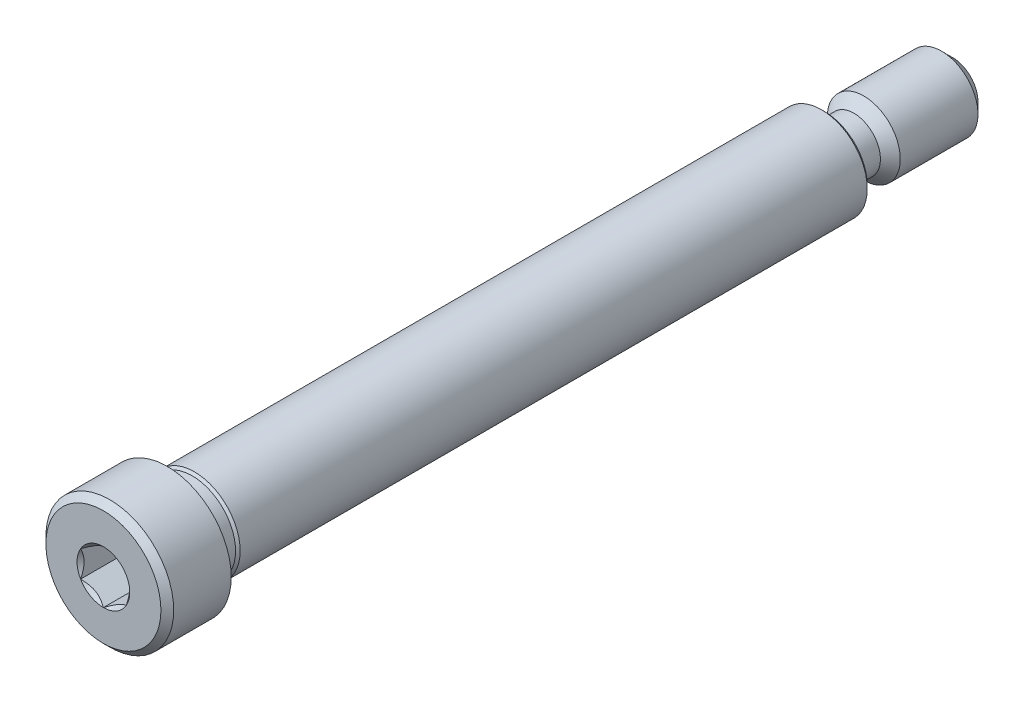
from build123d import *

# Parameters (mm, degrees)
CUT_EXTRUDE1_DEPTH = 4.1671875


with BuildPart() as part:
    # Sketch4 → Revolve1 (revolve)
    with BuildSketch(Plane(origin=(0, 0, 0), x_dir=(0, 0, -1), z_dir=(1, 0, 0)), mode=Mode.PRIVATE) as revolve1_sk:
        Polygon((-31.353125, 5.55625), (-36.35375, 5.55625), (-36.909375, 5.000625), (-36.909375, 0), (25.796875, 0), (25.796875, 3.704166667), (25.532291667, 3.96875), (-28.990925, 3.96875), (-29.1893625, 3.7703125), (-31.1546875, 3.7703125), (-31.353125, 3.96875), align=None)
    revolve(revolve1_sk.sketch.rotate(Axis((0, 0, 36.909375), (0, 0, -1)), 90), axis=Axis((0, 0, 36.909375), (0, 0, -1)))

    # Sketch5 → Cut-Extrude1 (cut)
    with BuildSketch(Plane.XY.offset(36.909375)):
        Polygon((1.984375, 1.14567944), (0, 2.291358881), (-1.984375, 1.14567944), (-1.984375, -1.14567944), (0, -2.291358881), (1.984375, -1.14567944), align=None)
    extrude(amount=-CUT_EXTRUDE1_DEPTH, mode=Mode.SUBTRACT)

    # Cut-Extrude4 cone 1 section (through the dimple's axis) → Cut-Extrude4 (revolve, cut)
    with BuildSketch(Plane(origin=(0, 0, 36.909375), x_dir=(0, -1, 0), z_dir=(1, 0, 0))):
        Polygon((0, 0), (2.291358881, 0), (0, 2.291358881), align=None)
    revolve(axis=Axis((0, 0, 36.909375), (0, 0, -1)), mode=Mode.SUBTRACT)

    # Sketch7 → Revolve2 (revolve)
    with BuildSketch(Plane(origin=(0, 0, 0), x_dir=(0, 0, -1), z_dir=(1, 0, 0)), mode=Mode.PRIVATE) as revolve2_sk:
        Polygon((25.796875, 3.175), (35.956875, 3.175), (36.909375, 2.2225), (36.909375, 0), (25.796875, 0), align=None)
    revolve(revolve2_sk.sketch.rotate(Axis((0, 0, -36.909375), (0, 0, 1)), 90), axis=Axis((0, 0, -36.909375), (0, 0, 1)))

    # Sketch10 → Cut-Revolve1 (revolve, cut)
    with BuildSketch(Plane(origin=(0, 0, 0), x_dir=(0, 0, -1), z_dir=(1, 0, 0)), mode=Mode.PRIVATE) as cut_revolve1_sk:
        with BuildLine():
            Line((26.660475, 2.3114), (28.336875, 2.3114))
            Line((28.336875, 2.3114), (29.994225, 3.96875))
            Line((29.994225, 3.96875), (25.796875, 3.96875))
            Line((25.796875, 3.96875), (25.796875, 3.175))
            ThreePointArc((25.796875, 3.175), (26.049817584, 2.564342584), (26.660475, 2.3114))
        make_face()
    revolve(cut_revolve1_sk.sketch.rotate(Axis((0, 0, -36.909375), (0, 0, 1)), 90), axis=Axis((0, 0, -36.909375), (0, 0, 1)), mode=Mode.SUBTRACT)


solid = part.part
